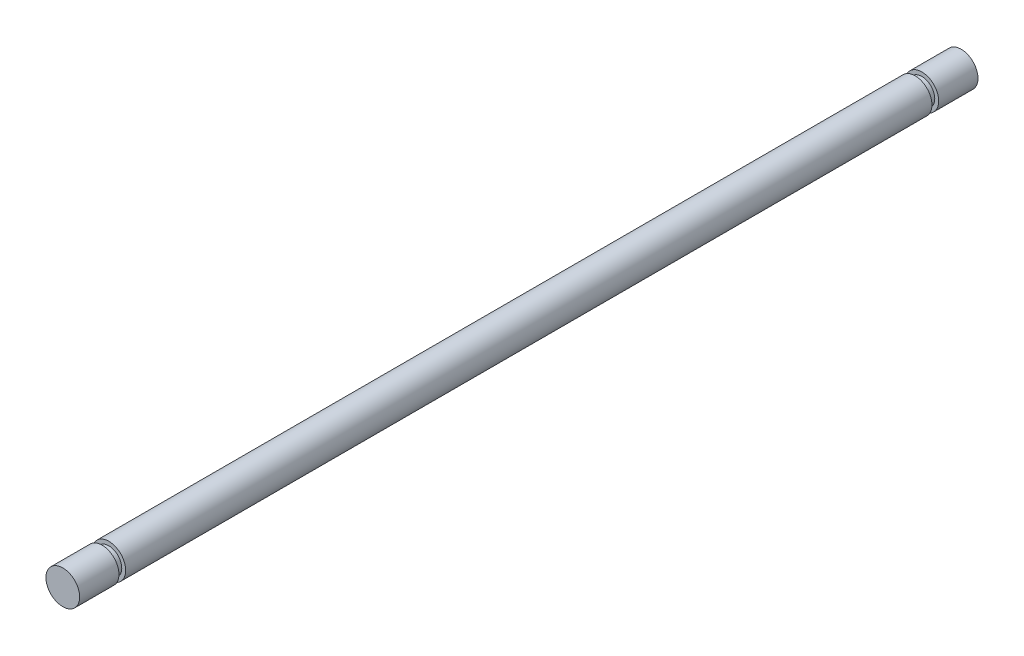
from build123d import *

# Parameters (mm, degrees)
SKETCH_1_R      = 1.5
EXTRUDE_1_DEPTH = 3.5
SKETCH_2_R      = 1.15
EXTRUDE_2_DEPTH = 0.6
SKETCH_3_R      = 1.5
EXTRUDE_3_DEPTH = 71.8
SKETCH_4_R      = 1.15
EXTRUDE_4_DEPTH = 0.6
SKETCH_5_R      = 1.5
EXTRUDE_5_DEPTH = 3.5


with BuildPart() as part:
    # 草图1 → 凸台-拉伸1 (new body)
    with BuildSketch(Plane.XY):
        Circle(SKETCH_1_R)
    extrude(amount=EXTRUDE_1_DEPTH)

    # 草图2 → 凸台-拉伸2 (add)
    with BuildSketch(Plane.XY.offset(3.5)):
        Circle(SKETCH_2_R)
    extrude(amount=EXTRUDE_2_DEPTH)

    # 草图3 → 凸台-拉伸3 (add)
    with BuildSketch(Plane.XY.offset(4.1)):
        Circle(SKETCH_3_R)
    extrude(amount=EXTRUDE_3_DEPTH)

    # 草图4 → 凸台-拉伸4 (add)
    with BuildSketch(Plane.XY.offset(75.9)):
        Circle(SKETCH_4_R)
    extrude(amount=EXTRUDE_4_DEPTH)

    # 草图5 → 凸台-拉伸5 (add)
    with BuildSketch(Plane.XY.offset(76.5)):
        Circle(SKETCH_5_R)
    extrude(amount=EXTRUDE_5_DEPTH)


solid = part.part
